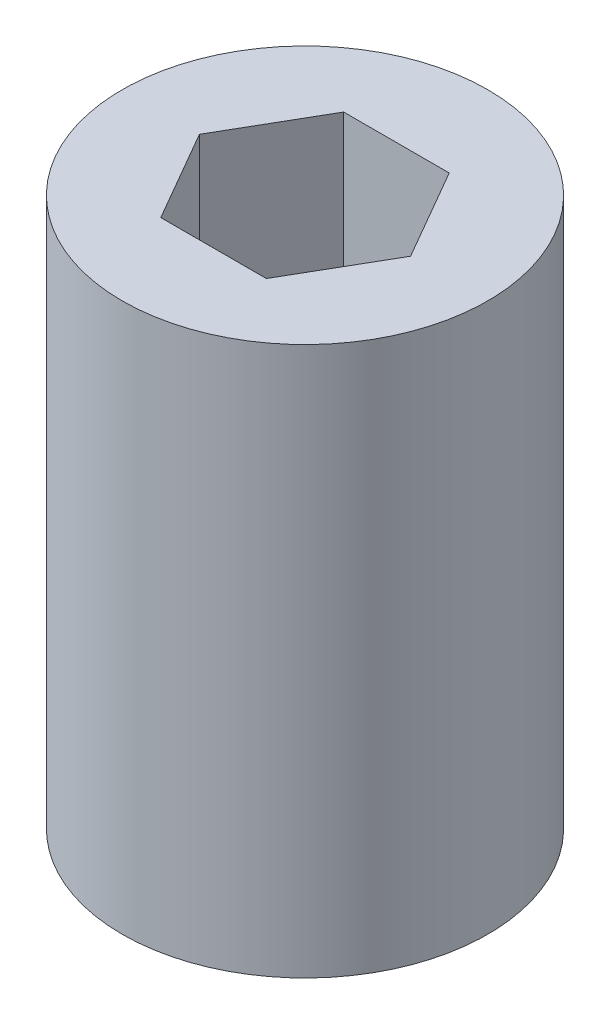
from build123d import *

# Parameters (mm, degrees)
SKETCH1_R           = 12.7
BOSS_EXTRUDE1_DEPTH = 38.1


with BuildPart() as part:
    # Sketch1 → Boss-Extrude1 (new body)
    with BuildSketch(Plane(origin=(0, 0, 0), x_dir=(1, 0, 0), z_dir=(0, 1, 0))):
        with Locations(Location((0, 0, 0), (0, 0, 90))):
            Circle(SKETCH1_R)
        Polygon((3.666174209, -6.35), (7.332348419, 0), (3.666174209, 6.35), (-3.666174209, 6.35), (-7.332348419, 0), (-3.666174209, -6.35), align=None, mode=Mode.SUBTRACT)
    extrude(amount=BOSS_EXTRUDE1_DEPTH)


solid = part.part
